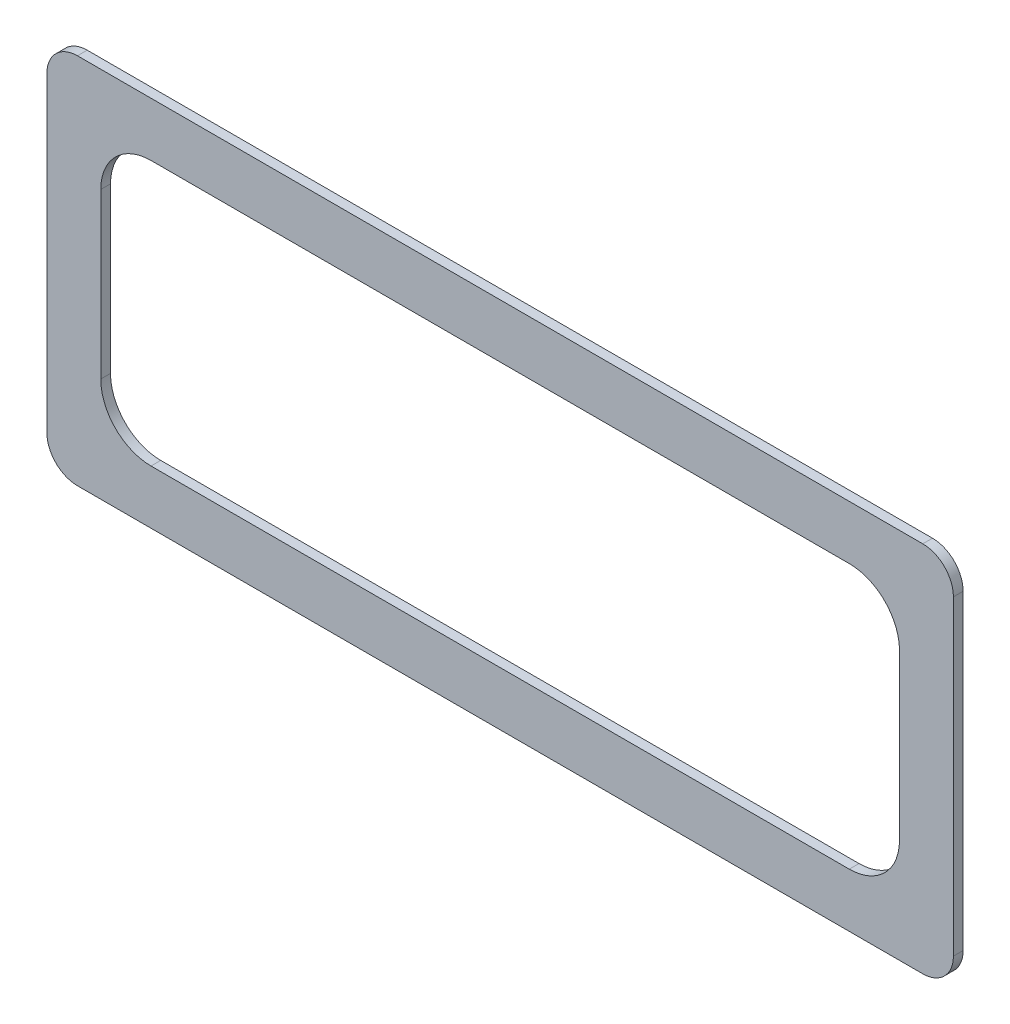
from build123d import *

# Parameters (mm, degrees)
BOSS_EXTRUDE1_DEPTH = 0.79375


with BuildPart() as part:
    # Sketch1 → Boss-Extrude1 (new body)
    with BuildSketch(Plane.XY):
        with BuildLine():
            Line((34, -12.7), (34, 12.7))
            ThreePointArc((34, 12.7), (33.267766953, 14.467766953), (31.5, 15.2))
            Line((31.5, 15.2), (-37.5, 15.2))
            ThreePointArc((-37.5, 15.2), (-39.267766953, 14.467766953), (-40, 12.7))
            Line((-40, 12.7), (-40, -12.7))
            ThreePointArc((-40, -12.7), (-39.267766953, -14.467766953), (-37.5, -15.2))
            Line((-37.5, -15.2), (31.5, -15.2))
            ThreePointArc((31.5, -15.2), (33.267766953, -14.467766953), (34, -12.7))
        make_face()
        with BuildLine():
            Line((29.6, -6.7), (29.6, 6.7))
            ThreePointArc((29.6, 6.7), (28.399137803, 9.599137803), (25.5, 10.8))
            Line((25.5, 10.8), (-31.5, 10.8))
            ThreePointArc((-31.5, 10.8), (-34.399137803, 9.599137803), (-35.6, 6.7))
            Line((-35.6, 6.7), (-35.6, -6.7))
            ThreePointArc((-35.6, -6.7), (-34.399137803, -9.599137803), (-31.5, -10.8))
            Line((-31.5, -10.8), (25.5, -10.8))
            ThreePointArc((25.5, -10.8), (28.399137803, -9.599137803), (29.6, -6.7))
        make_face(mode=Mode.SUBTRACT)
    extrude(amount=BOSS_EXTRUDE1_DEPTH)


solid = part.part
